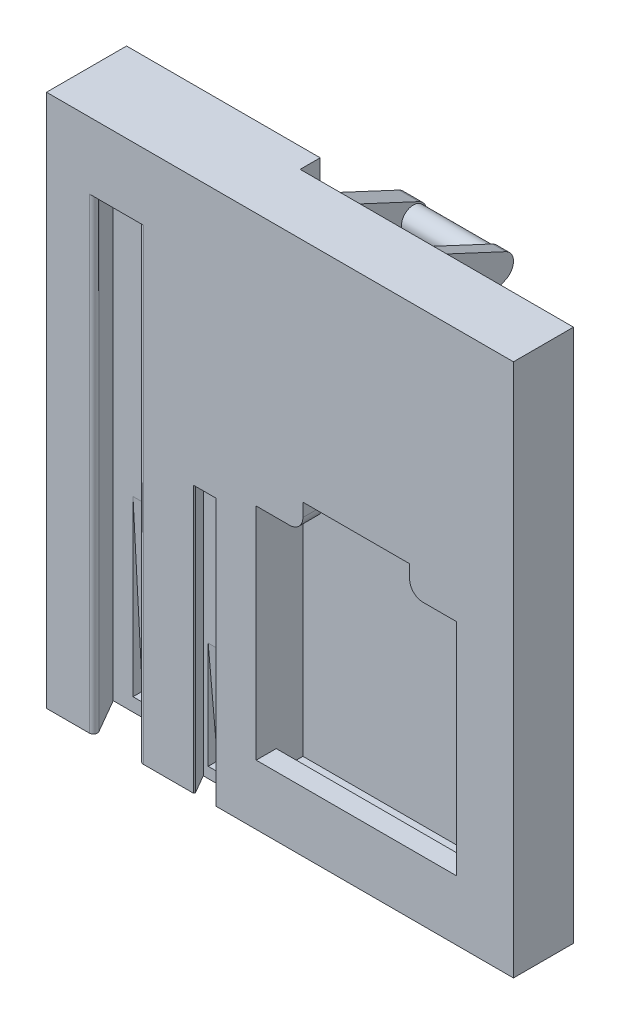
from build123d import *

# Parameters (mm, degrees)
SKETCH1_W           = 35
SKETCH1_H           = 40
BOSS_EXTRUDE1_DEPTH = 6
CUT_EXTRUDE1_DEPTH  = 35
FILLET4_R           = 0.3
CUT_EXTRUDE4_DEPTH  = 20
CHAMFER1_SIZE       = 0.1
SKETCH10_W          = 20.487766081
SKETCH10_H          = 1.5
CUT_EXTRUDE8_DEPTH  = 45.070965499
CUT_EXTRUDE9_DEPTH  = 1.75
CUT_EXTRUDE10_DEPTH = 1.25
SKETCH13_W          = 15
SKETCH13_H          = 20
CUT_EXTRUDE11_DEPTH = 3.5
SKETCH14_W          = 15
SKETCH14_H          = 1.5
SKETCH14_W_2        = 3.5
SKETCH14_H_2        = 2
BOSS_EXTRUDE2_DEPTH = 1.5
FILLET5_R           = 1
SKETCH15_R          = 0.9
BOSS_EXTRUDE3_DEPTH = 1.5
BOSS_EXTRUDE4_START = 7
SKETCH15_3_R        = 0.9
BOSS_EXTRUDE4_DEPTH = 1
SKETCH15_4_R        = 0.9
BOSS_EXTRUDE5_DEPTH = 8


with BuildPart() as part:
    # Sketch1 → Boss-Extrude1 (new body)
    with BuildSketch(Plane.XY):
        Rectangle(SKETCH1_W, SKETCH1_H)
    extrude(amount=BOSS_EXTRUDE1_DEPTH)

    # Sketch2 → Cut-Extrude1 (cut)
    with BuildSketch(Plane.XZ.offset(20)):
        Polygon((-10.767949192, 6), (-9.035898385, 3), (-15.5, 3), (-13.767949192, 6), align=None)
    extrude(amount=-CUT_EXTRUDE1_DEPTH, mode=Mode.SUBTRACT)

    # Fillet4
    fillet4_edges = [part.edges().sort_by_distance(p)[0] for p in [
        (-13.767949192, -2.5, 6),
        (-10.767949192, -2.5, 6),
    ]]
    fillet(fillet4_edges, radius=FILLET4_R)

    # Sketch5 → Cut-Extrude4 (cut)
    with BuildSketch(Plane.XZ.offset(20)):
        Polygon((-4.882308546, 6), (-4.016283143, 4.5), (-7.24833395, 4.5), (-6.382308546, 6), align=None)
    extrude(amount=-CUT_EXTRUDE4_DEPTH, mode=Mode.SUBTRACT)

    # Chamfer1
    chamfer1_edges = [part.edges().sort_by_distance(p)[0] for p in [
        (-6.382308546, -10, 6),
        (-4.882308546, -10, 6),
    ]]
    chamfer(chamfer1_edges, length=CHAMFER1_SIZE)

    # Sketch10 → Cut-Extrude8 (cut, through all)
    with BuildSketch(Plane.XZ.offset(20)):
        with Locations((7.256116959, 0.75)):
            Rectangle(SKETCH10_W, SKETCH10_H)
    extrude(amount=-CUT_EXTRUDE8_DEPTH, mode=Mode.SUBTRACT)

    # Sketch11 → Cut-Extrude9 (cut, symmetric)
    with BuildSketch(Plane(origin=(-12.267949192, 0, 0), x_dir=(0, 0, -1), z_dir=(1, 0, 0))):
        Polygon((-3, -19), (-3, -6), (-2.3, -19), align=None)
    extrude(amount=CUT_EXTRUDE9_DEPTH, both=True, mode=Mode.SUBTRACT)

    # Sketch12 → Cut-Extrude10 (cut, symmetric)
    with BuildSketch(Plane(origin=(-5.632308546, 0, 0), x_dir=(0, 0, -1), z_dir=(1, 0, 0))):
        Polygon((-4.5, -19.2), (-4.5, -11.198963388), (-3.8, -19.2), align=None)
    extrude(amount=CUT_EXTRUDE10_DEPTH, both=True, mode=Mode.SUBTRACT)

    # Sketch13 → Cut-Extrude11 (cut)
    with BuildSketch(Plane.XY.offset(6)):
        with Locations((5.717691454, -7)):
            Rectangle(SKETCH13_W, SKETCH13_H)
    extrude(amount=-CUT_EXTRUDE11_DEPTH, mode=Mode.SUBTRACT)

    # Sketch14 → Boss-Extrude2 (add)
    with BuildSketch(Plane.XY.offset(6)):
        with Locations((5.717691454, -16.25)):
            Rectangle(SKETCH14_W, SKETCH14_H)
        with Locations((-0.032308546, 2)):
            Rectangle(SKETCH14_W_2, SKETCH14_H_2)
        with Locations((11.467691454, 2)):
            Rectangle(SKETCH14_W_2, SKETCH14_H_2)
    extrude(amount=-BOSS_EXTRUDE2_DEPTH)

    # Fillet5
    fillet5_edges = [part.edges().sort_by_distance(p)[0] for p in [
        (1.717691454, 1, 5.25),
        (9.717691454, 1, 5.25),
    ]]
    fillet(fillet5_edges, radius=FILLET5_R)

    # Sketch15 → Boss-Extrude3 (add)
    # profile 1 of 2: a face of its own
    with BuildSketch(Plane(origin=(0, 0, 0), x_dir=(0, 0, -1), z_dir=(1, 0, 0))):
        with BuildLine():
            Line((2.922618262, 16.125083661), (-1.5, 14.062782897))
            Line((-1.5, 14.062782897), (-1.5, 20))
            Line((-1.5, 20), (2.922618262, 17.937699235))
            ThreePointArc((2.922618262, 17.937699235), (3.5, 17.031391448), (2.922618262, 16.125083661))
        make_face()
        with Locations((2.5, 17.031391448)):
            Circle(SKETCH15_R, mode=Mode.SUBTRACT)
    # profile 2 of 2: a face of its own
    with BuildSketch(Plane(origin=(0, 0, 0), x_dir=(0, 0, -1), z_dir=(1, 0, 0))):
        with BuildLine():
            ThreePointArc((2.922618262, -2.062300765), (3.5, -2.968608552), (2.922618262, -3.874916339))
            Line((2.922618262, -3.874916339), (-1.5, -5.937217103))
            Line((-1.5, -5.937217103), (-1.5, 0))
            Line((-1.5, 0), (2.922618262, -2.062300765))
        make_face()
        with Locations((2.5, -2.968608552)):
            Circle(SKETCH15_R, mode=Mode.SUBTRACT)
    extrude(amount=BOSS_EXTRUDE3_DEPTH)

    # Sketch15<3> → Boss-Extrude4 (add)
    # profile 1 of 2: a face of its own
    with BuildSketch(Plane(origin=(0, 0, 0), x_dir=(0, 0, -1), z_dir=(1, 0, 0)).offset(BOSS_EXTRUDE4_START)):
        with BuildLine():
            ThreePointArc((2.922618262, -2.062300765), (3.5, -2.968608552), (2.922618262, -3.874916339))
            Line((2.922618262, -3.874916339), (-1.5, -5.937217103))
            Line((-1.5, -5.937217103), (-1.5, 0))
            Line((-1.5, 0), (2.922618262, -2.062300765))
        make_face()
        with Locations((2.5, -2.968608552)):
            Circle(SKETCH15_3_R, mode=Mode.SUBTRACT)
    # profile 2 of 2: a face of its own
    with BuildSketch(Plane(origin=(0, 0, 0), x_dir=(0, 0, -1), z_dir=(1, 0, 0)).offset(BOSS_EXTRUDE4_START)):
        with BuildLine():
            Line((2.922618262, 16.125083661), (-1.5, 14.062782897))
            Line((-1.5, 14.062782897), (-1.5, 20))
            Line((-1.5, 20), (2.922618262, 17.937699235))
            ThreePointArc((2.922618262, 17.937699235), (3.5, 17.031391448), (2.922618262, 16.125083661))
        make_face()
        with Locations((2.5, 17.031391448)):
            Circle(SKETCH15_3_R, mode=Mode.SUBTRACT)
    extrude(amount=BOSS_EXTRUDE4_DEPTH)

    # Sketch15<4> → Boss-Extrude5 (add)
    with BuildSketch(Plane(origin=(0, 0, 0), x_dir=(0, 0, -1), z_dir=(1, 0, 0))):
        with Locations((2.5, 17.031391448)):
            Circle(SKETCH15_4_R)
        with Locations((2.5, -2.968608552)):
            Circle(SKETCH15_4_R)
    extrude(amount=BOSS_EXTRUDE5_DEPTH)


solid = part.part
